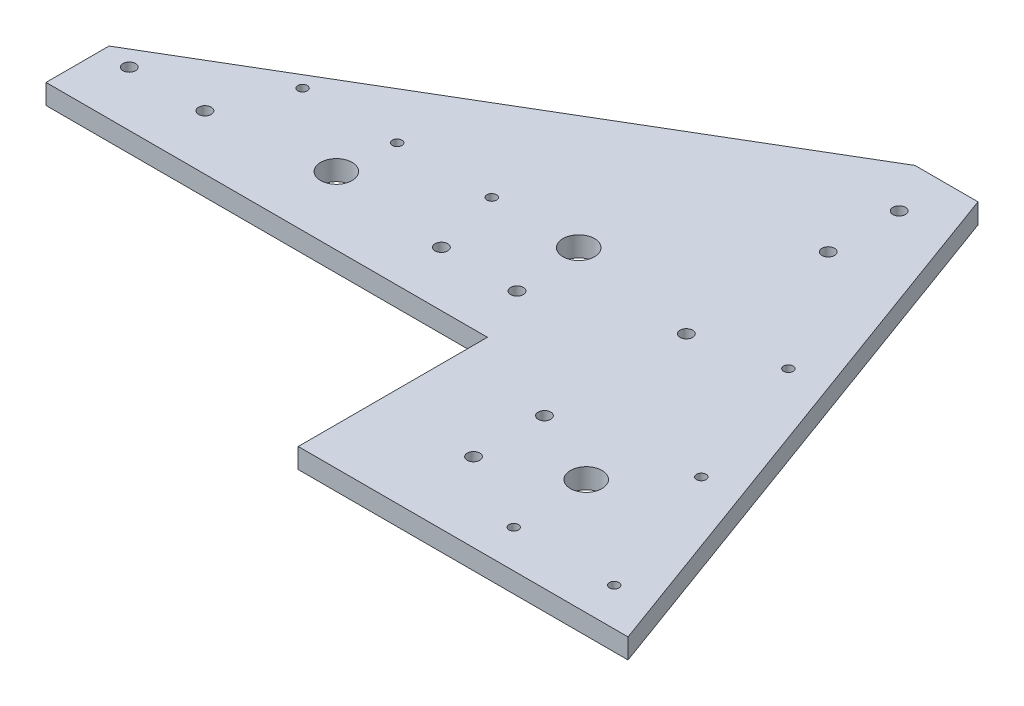
from build123d import *

# Parameters (mm, degrees)
SKETCH1_R           = 5
BOSS_EXTRUDE2_DEPTH = 6.35
SKETCH3_R           = 1.5
CUT_EXTRUDE1_DEPTH  = 6.35
SKETCH4_R           = 2
CUT_EXTRUDE2_DEPTH  = 10
SKETCH6_R           = 2
CUT_EXTRUDE3_DEPTH  = 6.35


with BuildPart() as part:
    # Sketch1 → Boss-Extrude2 (new body)
    with BuildSketch(Plane(origin=(0, 0, 0), x_dir=(1, 0, 0), z_dir=(0, 1, 0))):
        Polygon((180.6, 175), (160.6, 175), (0, 80), (0, 60), (70.5, 60), (140, 60), (140, 0), (194.75, 0), (244.6, 0), align=None)
        with Locations(Location((194.75, 36.59, 0), (0, 0, 270))):
            Circle(SKETCH1_R, mode=Mode.SUBTRACT)
        with BuildLine():
            ThreePointArc((75.5, 81.59), (74.035533906, 78.054466094), (70.5, 76.59))
            ThreePointArc((70.5, 76.59), (66.964466094, 85.125533906), (75.5, 81.59))
        make_face(mode=Mode.SUBTRACT)
        with Locations(Location((129.875, 99.09, 0), (0, 0, 270))):
            Circle(SKETCH1_R, mode=Mode.SUBTRACT)
    extrude(amount=BOSS_EXTRUDE2_DEPTH)

    # Sketch3 → Cut-Extrude1 (cut)
    with BuildSketch(Plane(origin=(0, 6.35, 0), x_dir=(1, 0, 0), z_dir=(0, 1, 0))):
        with Locations(Location((42.27958751, 99.09440108, 0), (0, 0, 270))):
            Circle(SKETCH3_R)
        with Locations(Location((196.359761891, 12, 0), (0, 0, 270))):
            Circle(SKETCH3_R)
        with Locations(Location((228.211428571, 12, 0), (0, 0, 270))):
            Circle(SKETCH3_R)
        with Locations(Location((212.285595231, 55.54720054, 0), (0, 0, 270))):
            Circle(SKETCH3_R)
        with Locations(Location((196.359761891, 99.09440108, 0), (0, 0, 270))):
            Circle(SKETCH3_R)
        with Locations(Location((102.27958751, 99.09440108, 0), (0, 0, 270))):
            Circle(SKETCH3_R)
        with Locations(Location((72.27958751, 99.09440108, 0), (0, 0, 270))):
            Circle(SKETCH3_R)
    extrude(amount=-CUT_EXTRUDE1_DEPTH, mode=Mode.SUBTRACT)

    # Sketch4 → Cut-Extrude2 (cut)
    with BuildSketch(Plane(origin=(0, 6.35, 0), x_dir=(1, 0, 0), z_dir=(0, 1, 0))):
        with BuildLine():
            ThreePointArc((172.6, 160), (172.014213562, 161.414213562), (170.6, 162))
            Line((170.6, 162), (170.6, 160))
            Line((170.6, 160), (170.6, 158))
            ThreePointArc((170.6, 158), (172.014213562, 158.585786438), (172.6, 160))
        make_face()
        with BuildLine():
            Line((170.6, 160), (170.6, 162))
            ThreePointArc((170.6, 162), (168.6, 160), (170.6, 158))
            Line((170.6, 158), (170.6, 160))
        make_face()
        with Locations(Location((170.6, 137.5, 0), (0, 0, 270))):
            Circle(SKETCH4_R)
        with Locations(Location((170.6, 92.5, 0), (0, 0, 270))):
            Circle(SKETCH4_R)
        with Locations(Location((170.6, 47.5, 0), (0, 0, 270))):
            Circle(SKETCH4_R)
        with Locations(Location((170.6, 25, 0), (0, 0, 270))):
            Circle(SKETCH4_R)
    extrude(amount=-CUT_EXTRUDE2_DEPTH, mode=Mode.SUBTRACT)

    # Sketch6 → Cut-Extrude3 (cut)
    with BuildSketch(Plane(origin=(0, 0, 0), x_dir=(-1, 0, 0), z_dir=(0, -1, 0))):
        with Locations(Location((-132, 77.4, 0), (0, 0, 90))):
            Circle(SKETCH6_R)
        with Locations(Location((-108, 77.4, 0), (0, 0, 90))):
            Circle(SKETCH6_R)
        with Locations(Location((-33, 77.4, 0), (0, 0, 90))):
            Circle(SKETCH6_R)
        with Locations(Location((-9, 77.4, 0), (0, 0, 90))):
            Circle(SKETCH6_R)
    extrude(amount=-CUT_EXTRUDE3_DEPTH, mode=Mode.SUBTRACT)


solid = part.part
